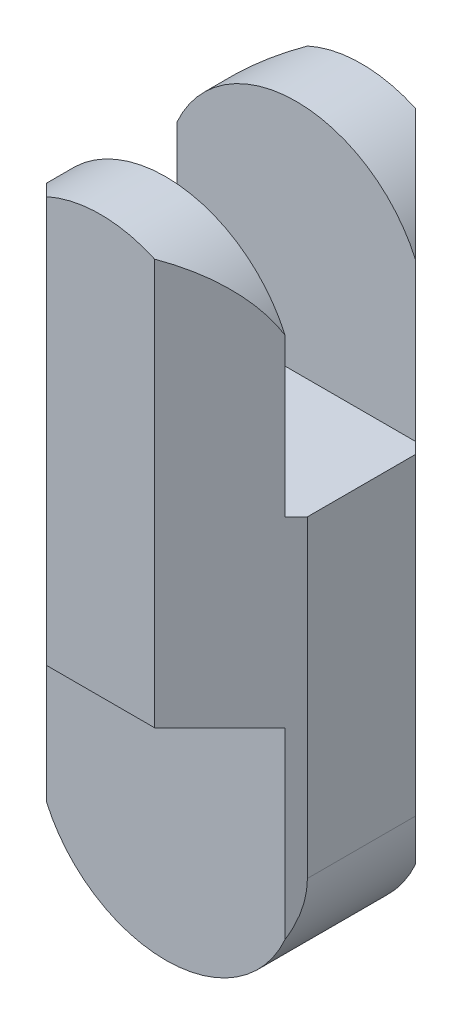
from build123d import *

# Parameters (mm, degrees)
EXTRUDE_1_DEPTH     = 54
CUT_EXTRUDE_1_DEPTH = 66
CUT_EXTRUDE_2_DEPTH = 5
CUT_EXTRUDE_START   = -5
CUT_EXTRUDE_3_DEPTH = 5
SKETCH_6_W          = 20
SKETCH_6_H          = 20
CUT_EXTRUDE_4_DEPTH = 5
CUT_EXTRUDE_5_DEPTH = 30


with BuildPart() as part:
    # 草图1 → 凸台-拉伸1 (new body)
    with BuildSketch(Plane(origin=(0, 0, 0), x_dir=(1, 0, 0), z_dir=(0, 1, 0))):
        Polygon((10, 4.142135624), (4.142135624, 10), (-4.142135624, 10), (-10, 4.142135624), (-10, -4.142135624), (-4.142135624, -10), (4.142135624, -10), (10, -4.142135624), align=None)
    extrude(amount=EXTRUDE_1_DEPTH)

    # 草图2 → 切除-拉伸1 (cut)
    with BuildSketch(Plane.XY.offset(10)):
        with BuildLine():
            Line((-10, 10), (-10, -2.389295552))
            Line((-10, -2.389295552), (10, -2.389295552))
            Line((10, -2.389295552), (10, 10))
            ThreePointArc((10, 10), (0, 0), (-10, 10))
        make_face()
    extrude(amount=-CUT_EXTRUDE_1_DEPTH, mode=Mode.SUBTRACT)

    # 草图4 → 切除-拉伸2 (cut)
    with BuildSketch(Plane.XY.offset(10)):
        with BuildLine():
            Line((-10, 10), (-10, 20))
            Line((-10, 20), (10, 20))
            Line((10, 20), (10, 10))
            ThreePointArc((10, 10), (0, 0), (-10, 10))
        make_face()
    extrude(amount=-CUT_EXTRUDE_2_DEPTH, mode=Mode.SUBTRACT)

    # 草图5 → 切除-拉伸3 (cut)
    with BuildSketch(Plane(origin=(0, 0, -10), x_dir=(-1, 0, 0), z_dir=(0, 0, -1)).offset(CUT_EXTRUDE_START)):
        with BuildLine():
            Line((-10, 10), (-10, 20))
            Line((-10, 20), (10, 20))
            Line((10, 20), (10, 10))
            ThreePointArc((10, 10), (0, 0), (-10, 10))
        make_face()
    extrude(amount=CUT_EXTRUDE_3_DEPTH, mode=Mode.SUBTRACT)

    # 草图6 → 切除-拉伸4 (cut, symmetric)
    with BuildSketch(Plane.XY):
        with Locations((0, 44)):
            Rectangle(SKETCH_6_W, SKETCH_6_H)
    extrude(amount=CUT_EXTRUDE_4_DEPTH, both=True, mode=Mode.SUBTRACT)

    # 草图7 → 切除-拉伸5 (cut)
    with BuildSketch(Plane.XY.offset(10)):
        with BuildLine():
            Line((-10, 42), (-10, 63.661192365))
            Line((-10, 63.661192365), (10, 63.661192365))
            Line((10, 63.661192365), (10, 42))
            ThreePointArc((10, 42), (0, 52), (-10, 42))
        make_face()
    extrude(amount=-CUT_EXTRUDE_5_DEPTH, mode=Mode.SUBTRACT)


solid = part.part
